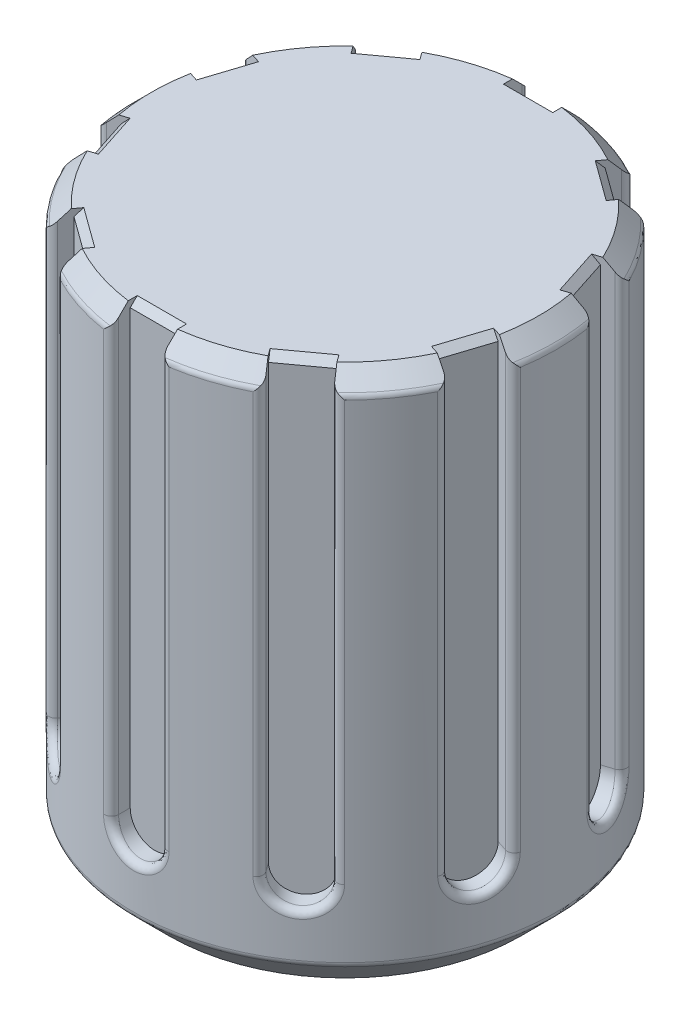
from build123d import *

# Parameters (mm, degrees)
SKETCH_1_R               = 6
EXTRUDE_1_DEPTH          = 16
SKETCH_2_R               = 3.75
CUT_EXTRUDE_1_DEPTH      = 4.5
SKETCH_4_R               = 3.1
CUT_EXTRUDE_2_DEPTH      = 13.5
SKETCH_5_R               = 13.5
CUT_EXTRUDE_3_DEPTH      = 0.5
CHAMFER_1_SIZE           = 0.5
CUT_EXTRUDE_START        = -5.4
CUT_EXTRUDE_4_DEPTH      = 4
PATTERN_CIRCULAR_1_COUNT = 10
CHAMFER_2_SIZE           = 0.2
CHAMFER_3_SIZE           = 0.4
CHAMFER_4_SIZE           = 1
FILLET_4_R               = 0.2


with BuildPart() as part:
    # 草图1 → 凸台-拉伸1 (new body)
    with BuildSketch(Plane(origin=(0, 0, 0), x_dir=(1, 0, 0), z_dir=(0, 1, 0))):
        with Locations(Location((0, 0, 0), (0, 0, 270))):
            Circle(SKETCH_1_R)
    extrude(amount=EXTRUDE_1_DEPTH)

    # 草图2 → 切除-拉伸1 (cut)
    with BuildSketch(Plane.XZ):
        with Locations(Location((0, 0, 0), (0, 0, 270))):
            Circle(SKETCH_2_R)
    extrude(amount=-CUT_EXTRUDE_1_DEPTH, mode=Mode.SUBTRACT)

    # 草图4 → 切除-拉伸2 (cut)
    with BuildSketch(Plane.XZ):
        with Locations(Location((0, 0, 0), (0, 0, 270))):
            Circle(SKETCH_4_R)
    extrude(amount=-CUT_EXTRUDE_2_DEPTH, mode=Mode.SUBTRACT)

    # 草图5 → 切除-拉伸3 (cut)
    with BuildSketch(Plane(origin=(0, 16, 0), x_dir=(1, 0, 0), z_dir=(0, 1, 0))):
        Circle(SKETCH_5_R)
    extrude(amount=-CUT_EXTRUDE_3_DEPTH, mode=Mode.SUBTRACT)

    # 倒角1
    chamfer_1_edges = [part.edges().sort_by_distance(p)[0] for p in [
        (0, 15.5, -6),
    ]]
    chamfer(chamfer_1_edges, length=CHAMFER_1_SIZE)

    # 草图6 → 切除-拉伸4 (cut)
    with BuildSketch(Plane.XY.offset(CUT_EXTRUDE_START)):
        with BuildLine():
            Line((0.7, 43), (0.7, 3))
            ThreePointArc((0.7, 3), (0, 2.3), (-0.7, 3))
            Line((-0.7, 3), (-0.7, 43))
            ThreePointArc((-0.7, 43), (0, 43.7), (0.7, 43))
        make_face()
    cut_extrude_4 = extrude(amount=-CUT_EXTRUDE_4_DEPTH, mode=Mode.SUBTRACT)

    # 阵列(圆周)1: 切除-拉伸4 ×10 about axis
    pattern_circular_1_axis = Axis((0, 0, 0), (0, 1, 0))
    for i in range(1, PATTERN_CIRCULAR_1_COUNT):
        add(cut_extrude_4.rotate(pattern_circular_1_axis, i * 360 / PATTERN_CIRCULAR_1_COUNT), mode=Mode.SUBTRACT)

    # 倒角2
    chamfer_2_edges = [part.edges().sort_by_distance(p)[0] for p in [
        (0, 15.5, -5.4),
        (-3.174040362, 15.5, -4.36869177),
        (-5.135705188, 15.5, -1.66869177),
        (-5.135705188, 15.5, 1.66869177),
        (-3.174040362, 15.5, 4.36869177),
        (0, 15.5, 5.4),
        (3.174040362, 15.5, 4.36869177),
        (5.135705188, 15.5, 1.66869177),
        (5.135705188, 15.5, -1.66869177),
        (3.174040362, 15.5, -4.36869177),
    ]]
    chamfer(chamfer_2_edges, length=CHAMFER_2_SIZE)

    # 倒角3
    chamfer_3_edges = [part.edges().sort_by_distance(p)[0] for p in [
        (0, 0, 3.75),
    ]]
    chamfer(chamfer_3_edges, length=CHAMFER_3_SIZE)

    # 倒角4
    chamfer_4_edges = [part.edges().sort_by_distance(p)[0] for p in [
        (0, 0, -6),
    ]]
    chamfer(chamfer_4_edges, length=CHAMFER_4_SIZE)

    # 圆角4
    fillet_4_edges = [part.edges().sort_by_distance(p)[0] for p in [
        (0, 2.3, -6),
        (-0.7, 9, -5.959026766),
        (0.7, 9, -5.959026766),
        (-3.526711514, 2.3, -4.854101966),
        (-4.068939947, 9, -4.409504247),
        (-2.936316155, 9, -5.2324036),
        (4.068939947, 9, -4.409504247),
        (2.936316155, 9, -5.2324036),
        (4.068939947, 9, -4.409504247),
        (5.706339098, 2.3, -1.854101966),
        (5.451059341, 9, -2.507180102),
        (5.883683133, 9, -1.175700979),
        (5.451059341, 9, 2.507180102),
        (5.883683133, 9, 1.175700979),
        (5.451059341, 9, 2.507180102),
        (2.936316155, 9, 5.2324036),
        (4.068939947, 9, 4.409504247),
        (2.936316155, 9, 5.2324036),
        (-0.7, 9, 5.959026766),
        (0.7, 9, 5.959026766),
        (-0.7, 9, 5.959026766),
        (-4.068939947, 9, 4.409504247),
        (-2.936316155, 9, 5.2324036),
        (-4.068939947, 9, 4.409504247),
        (-5.883683133, 9, 1.175700979),
        (-5.451059341, 9, 2.507180102),
        (-5.883683133, 9, 1.175700979),
        (-5.451059341, 9, -2.507180102),
        (-5.883683133, 9, -1.175700979),
        (-5.451059341, 9, -2.507180102),
        (-6, 15, 0),
        (-4.854101966, 15, 3.526711514),
        (-1.854101966, 15, 5.706339098),
        (1.854101966, 15, 5.706339098),
        (4.854101966, 15, 3.526711514),
        (6, 15, 0),
        (4.854101966, 15, -3.526711514),
        (-4.854101966, 15, -3.526711514),
        (-1.854101966, 15, -5.706339098),
        (1.854101966, 15, -5.706339098),
        (0, 1, -6),
    ]]
    fillet(fillet_4_edges, radius=FILLET_4_R)


solid = part.part
